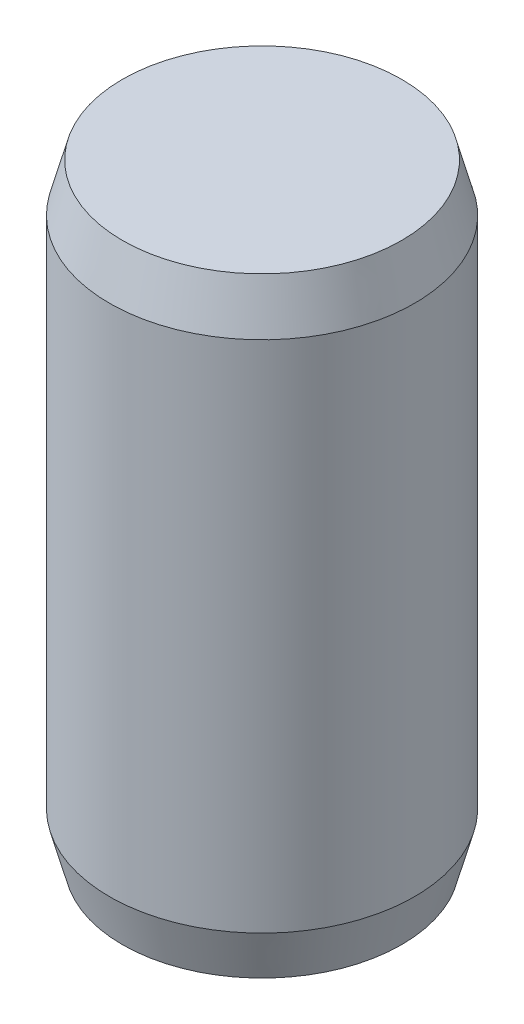
from build123d import *

# Parameters (mm, degrees)
SKETCH_1_W = 2
SKETCH_1_H = 8


with BuildPart() as part:
    # 草图1 → 旋转1 (revolve)
    with BuildSketch(Plane.XY):
        with Locations((1, 0)):
            Rectangle(SKETCH_1_W, SKETCH_1_H)
    revolve(axis=Axis((0, -4, 0), (0, 1, 0)))

    # 草图2 → 切除-旋转1 (revolve, cut)
    with BuildSketch(Plane.XY):
        Polygon((1.831192009, -4), (2, -3.37), (2.1, -3.37), (2.1, -4.1), (1.831192009, -4.1), align=None)
    cut_revolve_1 = revolve(axis=Axis((0, 0, 0), (0, -1, 0)), mode=Mode.SUBTRACT)

    # 镜向1: 切除-旋转1 across plane
    add(cut_revolve_1.mirror(Plane.ZX), mode=Mode.SUBTRACT)


solid = part.part
